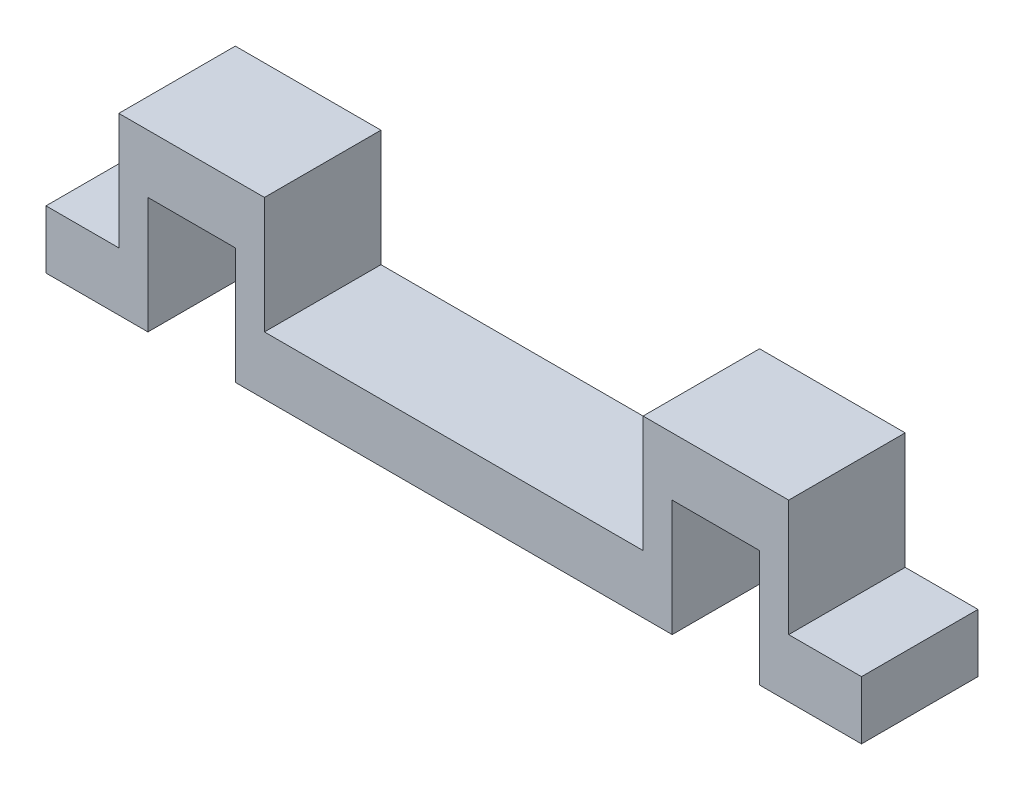
from build123d import *

# Parameters (mm, degrees)
BOSS_EXTRUDE1_DEPTH = 20


with BuildPart() as part:
    # Sketch1 → Boss-Extrude1 (new body)
    with BuildSketch(Plane.XY):
        Polygon((-37.5, 0), (37.5, 0), (37.5, 20), (52.5, 20), (52.5, 0), (70, 0), (70, 10), (57.5, 10), (57.5, 30), (32.5, 30), (32.5, 10), (-32.5, 10), (-32.5, 30), (-57.5, 30), (-57.5, 10), (-70, 10), (-70, 0), (-52.5, 0), (-52.5, 20), (-37.5, 20), align=None)
    extrude(amount=BOSS_EXTRUDE1_DEPTH)


solid = part.part
